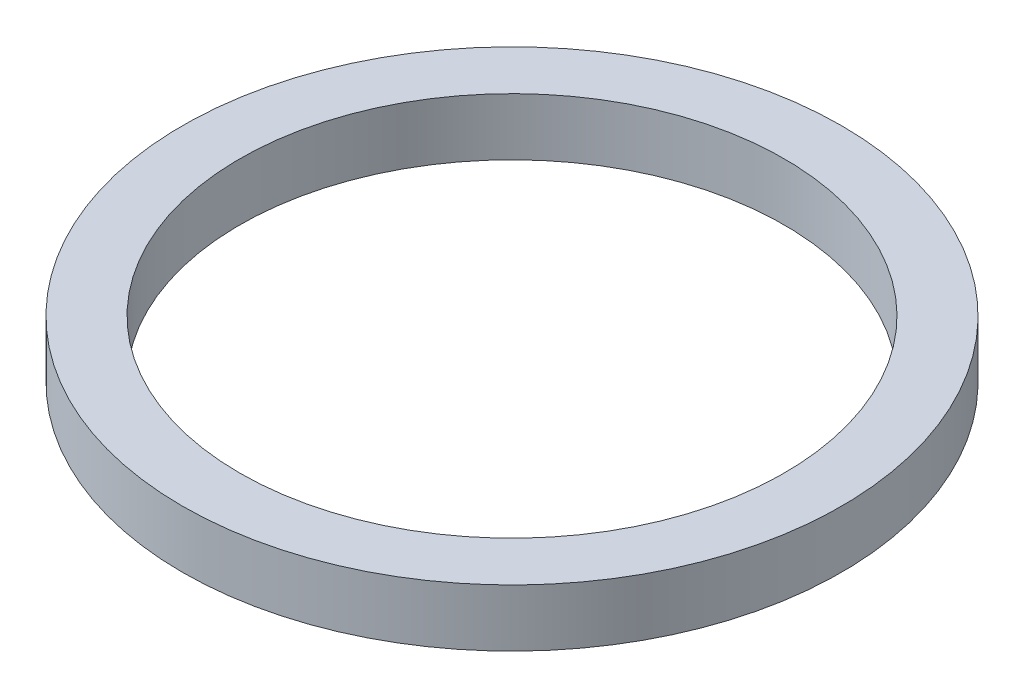
from build123d import *

# Parameters (mm, degrees)
SKETCH1_R           = 5.75
SKETCH1_R_2         = 4.75
BOSS_EXTRUDE1_DEPTH = 1


with BuildPart() as part:
    # Sketch1 → Boss-Extrude1 (new body)
    with BuildSketch(Plane(origin=(0, 0, 0), x_dir=(1, 0, 0), z_dir=(0, 1, 0))):
        with Locations(Location((0, 0, 0), (0, 0, 270))):
            Circle(SKETCH1_R)
        with Locations(Location((0, 0, 0), (0, 0, 270))):
            Circle(SKETCH1_R_2, mode=Mode.SUBTRACT)
    extrude(amount=BOSS_EXTRUDE1_DEPTH)


solid = part.part
